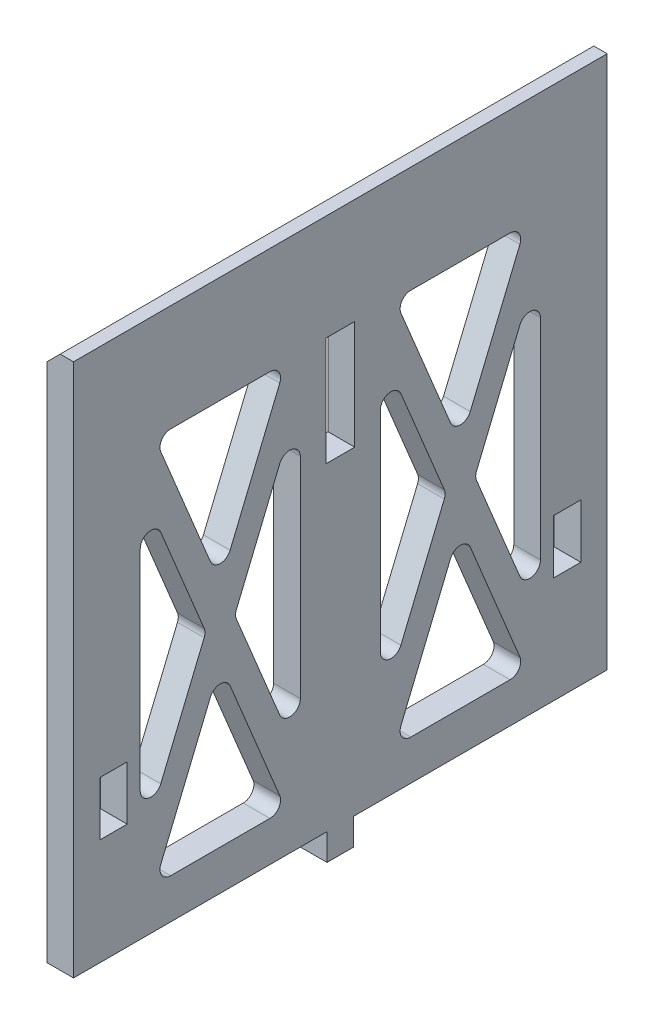
from build123d import *

# Parameters (mm, degrees)
SKETCH4_W           = 6.858
SKETCH4_H           = 25.908
SKETCH4_W_2         = 6.5024
SKETCH4_H_2         = 12.8524
BOSS_EXTRUDE1_DEPTH = 6.35
CUT_EXTRUDE1_DEPTH  = 150.225
FILLET1_R           = 2.54
CHAMFER1_SIZE       = 3.175


with BuildPart() as part:
    # Sketch4 → Boss-Extrude1 (new body)
    with BuildSketch(Plane(origin=(0, 0, 0), x_dir=(0, 0, -1), z_dir=(1, 0, 0))):
        Polygon((0, 6.35), (-60.325, 6.35), (-60.325, 32.004), (-60.325, 44.704), (-60.325, 133.35), (66.675, 133.35), (66.675, 44.704), (66.675, 32.004), (66.675, 6.35), (6.35, 6.35), (6.35, 0), (0, 0), align=None)
        with Locations((3.175, 95.25)):
            Rectangle(SKETCH4_W, SKETCH4_H, mode=Mode.SUBTRACT)
        with Locations((-50.8, 38.1)):
            Rectangle(SKETCH4_W_2, SKETCH4_H_2, mode=Mode.SUBTRACT)
        with Locations((57.15, 38.1)):
            Rectangle(SKETCH4_W_2, SKETCH4_H_2, mode=Mode.SUBTRACT)
    extrude(amount=BOSS_EXTRUDE1_DEPTH)

    # Sketch5 → Cut-Extrude1 (cut, through all)
    with BuildSketch(Plane(origin=(6.35, 0, 0), x_dir=(0, 0, -1), z_dir=(1, 0, 0))):
        Polygon((-28.836084591, 61.9125), (-44.45, 99.646128904), (-44.45, 24.178871096), align=None)
        Polygon((-9.786084591, 107.95), (-41.013915409, 107.95), (-25.4, 70.216371096), align=None)
        Polygon((-9.786084591, 15.875), (-25.4, 53.608628904), (-41.013915409, 15.875), align=None)
        Polygon((28.313915409, 61.9125), (12.7, 99.646128904), (12.7, 24.178871096), align=None)
        Polygon((47.363915409, 107.95), (16.136084591, 107.95), (31.75, 70.216371096), align=None)
        Polygon((50.8, 99.646128904), (35.186084591, 61.9125), (50.8, 24.178871096), align=None)
        Polygon((47.363915409, 15.875), (31.75, 53.608628904), (16.136084591, 15.875), align=None)
        Polygon((-6.35, 99.646128904), (-21.963915409, 61.9125), (-6.35, 24.178871096), align=None)
    extrude(amount=-CUT_EXTRUDE1_DEPTH, mode=Mode.SUBTRACT)

    # Fillet1
    fillet1_edges = [part.edges().sort_by_distance(p)[0] for p in [
        (3.175, 53.608628904, 25.4),
        (3.175, 15.875, 9.786084591),
        (3.175, 70.216371096, -31.75),
        (3.175, 107.95, -16.136084591),
        (3.175, 107.95, -47.363915409),
        (3.175, 61.9125, -28.313915409),
        (3.175, 24.178871096, -12.7),
        (3.175, 99.646128904, -12.7),
        (3.175, 15.875, -47.363915409),
        (3.175, 15.875, -16.136084591),
        (3.175, 53.608628904, -31.75),
        (3.175, 24.178871096, -50.8),
        (3.175, 61.9125, -35.186084591),
        (3.175, 99.646128904, -50.8),
        (3.175, 61.9125, 21.963915409),
        (3.175, 99.646128904, 6.35),
        (3.175, 24.178871096, 6.35),
        (3.175, 24.178871096, 44.45),
        (3.175, 99.646128904, 44.45),
        (3.175, 61.9125, 28.836084591),
        (3.175, 70.216371096, 25.4),
        (3.175, 107.95, 41.013915409),
        (3.175, 107.95, 9.786084591),
        (3.175, 15.875, 41.013915409),
    ]]
    fillet(fillet1_edges, radius=FILLET1_R)

    # Chamfer1
    chamfer1_edges = [part.edges().sort_by_distance(p)[0] for p in [
        (0, 133.35, -3.175),
    ]]
    chamfer(chamfer1_edges, length=CHAMFER1_SIZE)


solid = part.part
